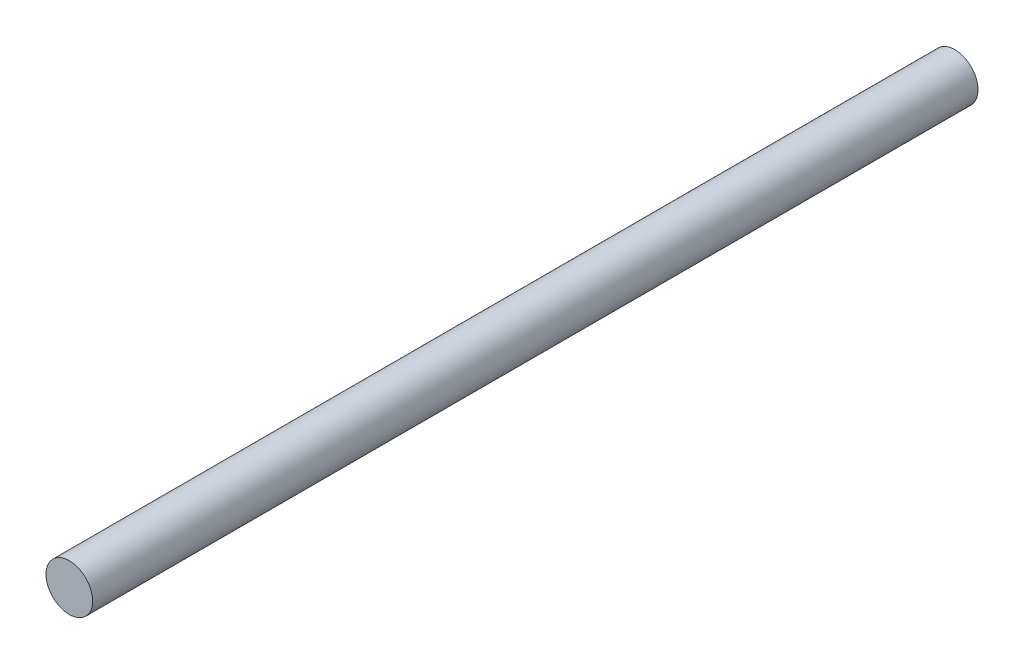
from build123d import *

# Parameters (mm, degrees)
SKETCH1_R           = 8.026567891
BOSS_EXTRUDE1_DEPTH = 304.8


with BuildPart() as part:
    # Sketch1 → Boss-Extrude1 (new body)
    with BuildSketch(Plane.XY):
        with Locations(Location((0, 0, 0), (0, 0, 180))):
            Circle(SKETCH1_R)
    extrude(amount=BOSS_EXTRUDE1_DEPTH)


solid = part.part
